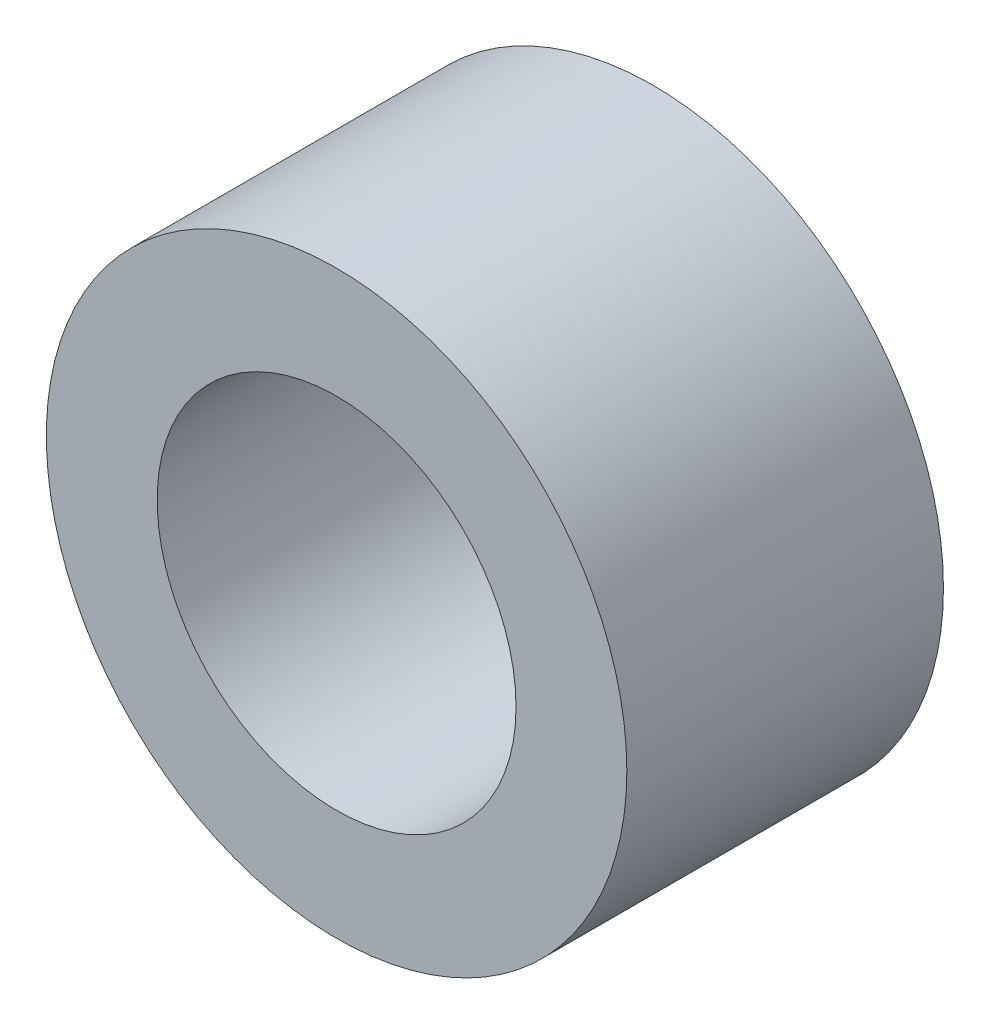
from build123d import *

# Parameters (mm, degrees)
SKETCH_1_R      = 2.75
SKETCH_1_R_2    = 1.7
EXTRUDE_1_DEPTH = 3


with BuildPart() as part:
    # 草图1 → 凸台-拉伸1 (new body)
    with BuildSketch(Plane.XY):
        Circle(SKETCH_1_R)
        Circle(SKETCH_1_R_2, mode=Mode.SUBTRACT)
    extrude(amount=EXTRUDE_1_DEPTH)


solid = part.part
